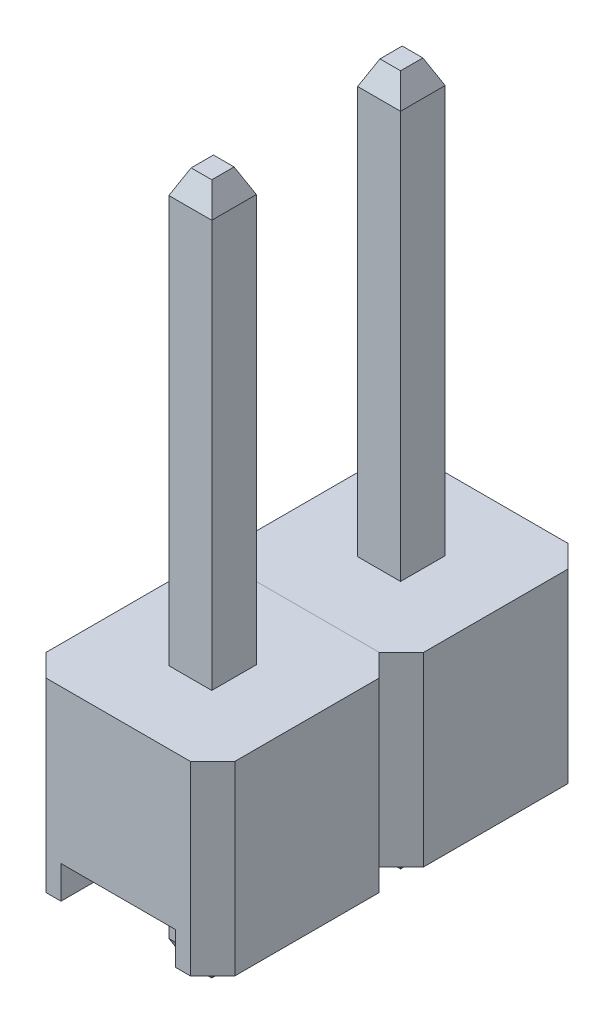
from build123d import *

# Parameters (mm, degrees)
CUERPO_PL_STICO_DEPTH = 2.5
CROQUIS2_W            = 1.54
CROQUIS2_H            = 2.54
RANURA_DEPTH          = 0.44
PIN_DEPTH             = 5.8
PIN_DEPTH_BACK        = 3.5
CROQUIS3_W            = 0.57750613
CROQUIS3_H            = 0.6
CHAFL_N1_SIZE         = 0.15
CHAFL_N1_SIZE2        = 0.321676038
CHAFL_N2_SIZE         = 0.15
CHAFL_N2_SIZE2        = 0.321676038
MATRIZ_COUNT          = 2
MATRIZ_PITCH          = 2.54


with BuildPart() as part:
    # Croquis1 → Cuerpo Plástico (new body)
    with BuildSketch(Plane(origin=(0, 0, 0), x_dir=(1, 0, 0), z_dir=(0, 1, 0))):
        Polygon((0.3, 0), (2.24, 0), (2.54, 0.3), (2.54, 2.24), (2.24, 2.54), (0.3, 2.54), (0, 2.24), (0, 0.3), align=None)
    extrude(amount=CUERPO_PL_STICO_DEPTH)

    # Croquis2 → Ranura (cut)
    with BuildSketch(Plane.XZ):
        with Locations((1.27, -1.27)):
            Rectangle(CROQUIS2_W, CROQUIS2_H)
    extrude(amount=-RANURA_DEPTH, mode=Mode.SUBTRACT)

    # Croquis3 → Pin (add, two sides: drawn at the far end of the back side and taken through both)
    with BuildSketch(Plane(origin=(0, 2.5, 0), x_dir=(1, 0, 0), z_dir=(0, 1, 0)).offset(-PIN_DEPTH_BACK)):
        with Locations((1.27, 1.27)):
            Rectangle(CROQUIS3_W, CROQUIS3_H)
    extrude(amount=PIN_DEPTH + PIN_DEPTH_BACK)

    # Chaflán1
    chafl_n1_edges = [part.edges().sort_by_distance(p)[0] for p in [
        (0.981246935, 8.3, -1.27),
        (1.27, 8.3, -0.97),
        (1.558753065, 8.3, -1.27),
        (1.27, 8.3, -1.57),
    ]]
    chafl_n1_side = [part.faces().sort_by_distance(p)[0] for p in [
        (1.27, 8.3, -1.27),
    ]]
    chamfer(chafl_n1_edges, length=CHAFL_N1_SIZE, length2=CHAFL_N1_SIZE2, reference=chafl_n1_side[0])

    # Chaflán2
    chafl_n2_edges = [part.edges().sort_by_distance(p)[0] for p in [
        (0.981246935, -1, -1.27),
        (1.27, -1, -1.57),
        (1.558753065, -1, -1.27),
        (1.27, -1, -0.97),
    ]]
    chafl_n2_side = [part.faces().sort_by_distance(p)[0] for p in [
        (1.27, -1, -1.27),
    ]]
    chamfer(chafl_n2_edges, length=CHAFL_N2_SIZE, length2=CHAFL_N2_SIZE2, reference=chafl_n2_side[0])


with BuildPart() as matriz_1:
    # Matriz: pattern copy
    add(part.part.moved(Location(Vector(0, 0, 1) * (1 * MATRIZ_PITCH))))


solid = Compound([part.part, matriz_1.part])
